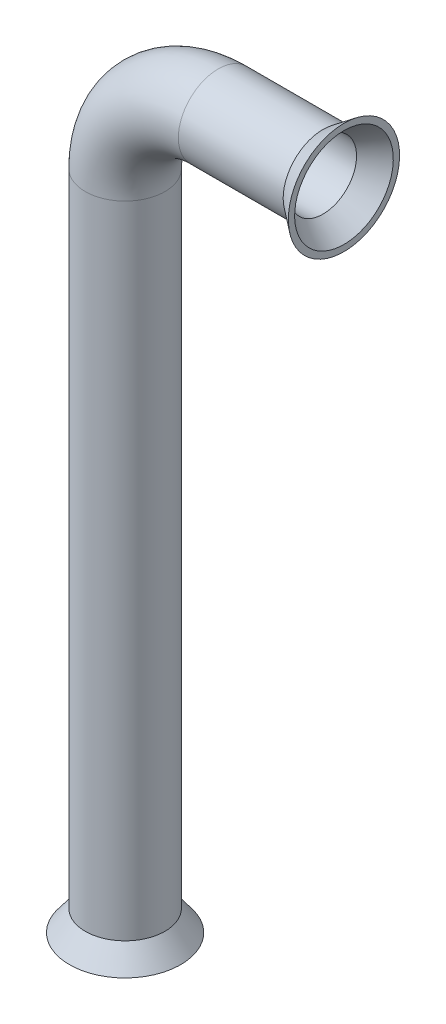
from build123d import *

# Parameters (mm, degrees)
SKETCH1_R           = 4.826
SKETCH1_R_2         = 4.064
SKETCH3_R           = 4.826
BOSS_EXTRUDE1_DEPTH = 2.54
BOSS_EXTRUDE1_DRAFT = -37
SKETCH5_R           = 4.826
BOSS_EXTRUDE2_DEPTH = 2.54
BOSS_EXTRUDE2_DRAFT = -37


with BuildPart() as part:
    # Sweep1: sweep along a path in Sketch2
    with BuildLine(Plane.XY) as sweep1_path:
        Line((0, 0), (0, 77.6224))
        ThreePointArc((0, 77.6224), (3.303132564, 85.596867436), (11.2776, 88.9))
        Line((11.2776, 88.9), (23.9776, 88.9))
    # Sketch1 → Sweep1 (sweep)
    with BuildSketch(Plane(origin=(0, 0, 0), x_dir=(1, 0, 0), z_dir=(0, 1, 0))):
        Circle(SKETCH1_R)
        Circle(SKETCH1_R_2, mode=Mode.SUBTRACT)
    sweep(path=sweep1_path.line)


with BuildPart() as boss_extrude1_tool:
    # Sketch3 → Boss-Extrude1 (with draft: the straight prism first)
    with BuildSketch(Plane.XZ):
        with Locations(Location((0, 0, 0), (0, 0, 180))):
            Circle(SKETCH3_R)
    extrude(amount=BOSS_EXTRUDE1_DEPTH)
    # Boss-Extrude1: the draft: its side faces are tilted about the plane it starts from
    boss_extrude1_sides = [boss_extrude1_tool.faces().sort_by_distance(p)[0] for p in [
        (4.826, -1.27, 0),
    ]]
    draft(boss_extrude1_sides, Plane.XZ, BOSS_EXTRUDE1_DRAFT)


with BuildPart() as part_1:
    add(part.part)

    # Boss-Extrude1: add boss_extrude1_tool
    add(boss_extrude1_tool.part)

    # Cut-Extrude1 cone 1 section (through the dimple's axis) → Cut-Extrude1 (revolve, cut)
    with BuildSketch(Plane(origin=(0, -2.54, 0), x_dir=(0, 0, -1), z_dir=(1, 0, 0))):
        Polygon((0, 0), (5.978027287, 0), (0, 7.933110155), align=None)
    revolve(axis=Axis((0, -2.54, 0), (0, 1, 0)), mode=Mode.SUBTRACT)


with BuildPart() as boss_extrude2_tool:
    # Sketch5 → Boss-Extrude2 (with draft: the straight prism first)
    with BuildSketch(Plane(origin=(23.9776, 0, 0), x_dir=(0, 0, -1), z_dir=(1, 0, 0))):
        with Locations(Location((0, 88.9, 0), (0, 0, 90))):
            Circle(SKETCH5_R)
    extrude(amount=BOSS_EXTRUDE2_DEPTH)
    # Boss-Extrude2: the draft: its side faces are tilted about the plane it starts from
    boss_extrude2_sides = [boss_extrude2_tool.faces().sort_by_distance(p)[0] for p in [
        (25.2476, 84.074, 0),
    ]]
    draft(boss_extrude2_sides, Plane(origin=(23.9776, 0, 0), x_dir=(0, 0, -1), z_dir=(1, 0, 0)), BOSS_EXTRUDE2_DRAFT)


with BuildPart() as part_2:
    add(part_1.part)

    # Boss-Extrude2: add boss_extrude2_tool
    add(boss_extrude2_tool.part)

    # Cut-Extrude2 cone 1 section (through the dimple's axis) → Cut-Extrude2 (revolve, cut)
    with BuildSketch(Plane(origin=(26.5176, 88.9, 0), x_dir=(0, 0, -1), z_dir=(0, 1, 0))):
        Polygon((0, 0), (5.978027287, 0), (0, 7.933110155), align=None)
    revolve(axis=Axis((26.5176, 88.9, 0), (-1, 0, 0)), mode=Mode.SUBTRACT)


solid = part_2.part
